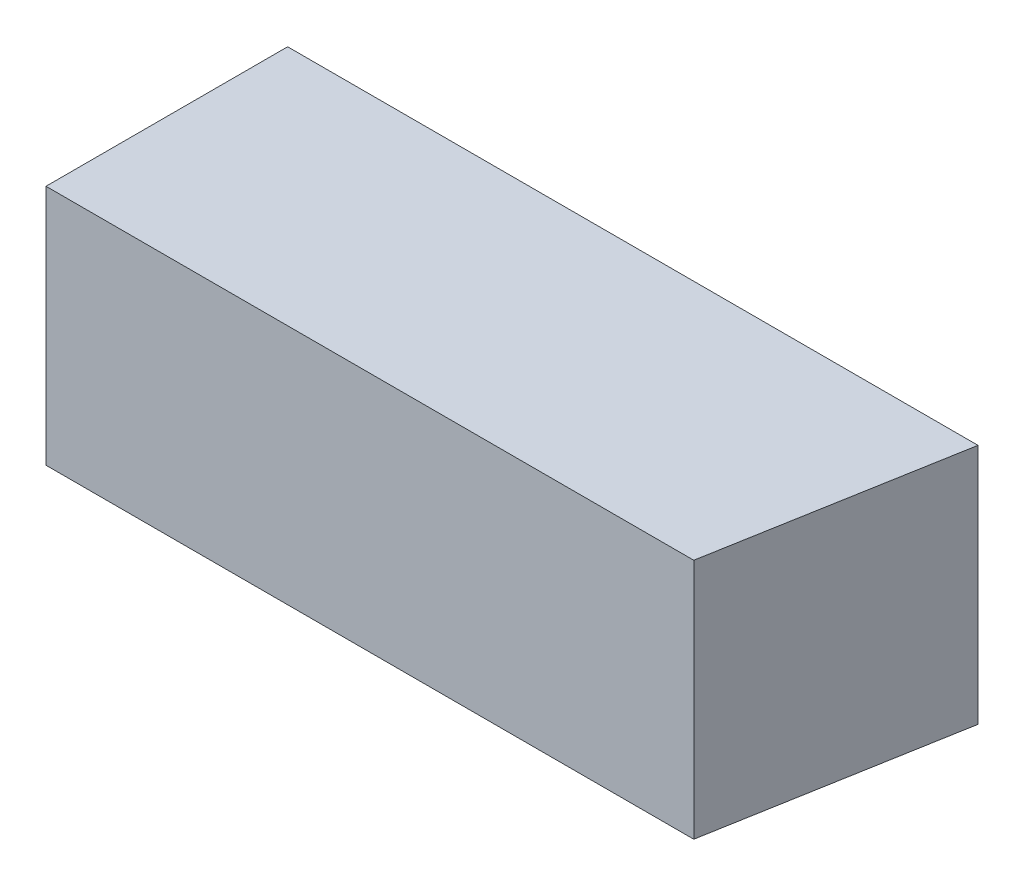
from build123d import *

# Parameters (mm, degrees)
SKETCH1_W           = 88.9
SKETCH1_H           = 88.9
BOSS_EXTRUDE1_DEPTH = 254
CUT_EXTRUDE1_DEPTH  = 88.9


with BuildPart() as part:
    # Sketch1 → Boss-Extrude1 (new body)
    with BuildSketch(Plane.YZ):
        with Locations((44.45, 44.45)):
            Rectangle(SKETCH1_W, SKETCH1_H)
    extrude(amount=BOSS_EXTRUDE1_DEPTH)

    # Sketch2 → Cut-Extrude1 (cut)
    with BuildSketch(Plane(origin=(0, 0, 0), x_dir=(-1, 0, 0), z_dir=(0, 1, 0))):
        Polygon((-254, 0), (-238.32693, 88.9), (-254, 88.9), align=None)
    extrude(amount=CUT_EXTRUDE1_DEPTH, mode=Mode.SUBTRACT)


solid = part.part
